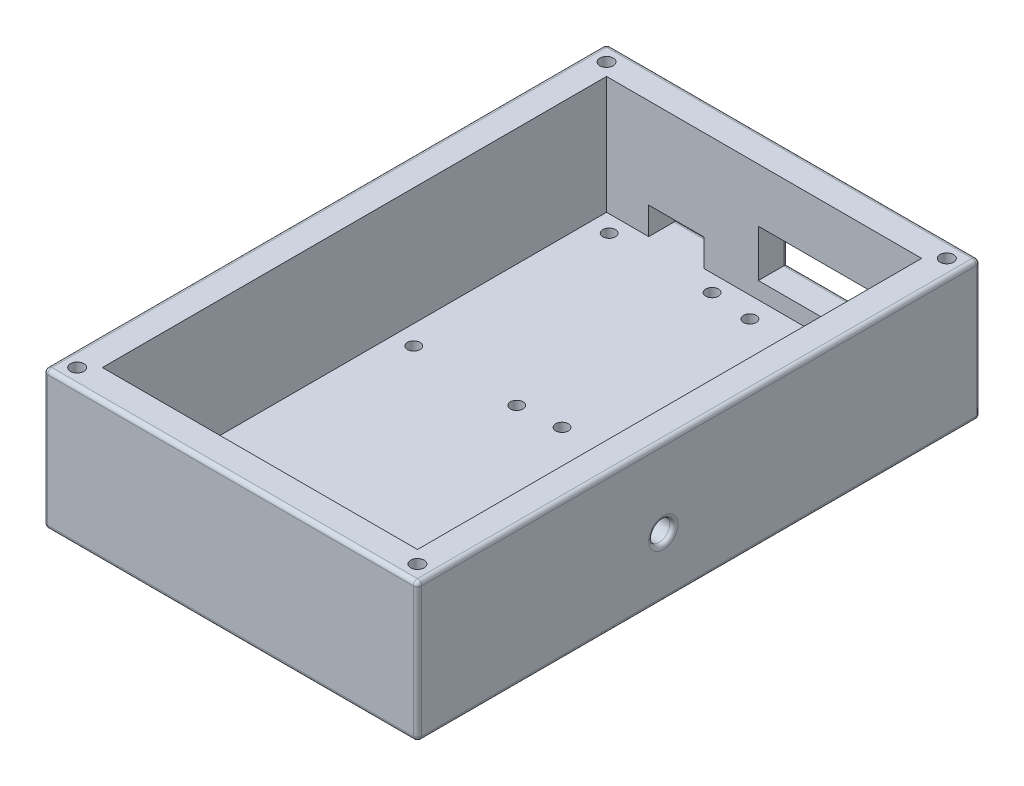
from build123d import *

# Parameters (mm, degrees)
SKETCH_1_W          = 89
SKETCH_1_H          = 134
EXTRUDE_2_DEPTH     = 16.5
SKETCH_4_W          = 75
SKETCH_4_H          = 120
CUT_EXTRUDE_1_DEPTH = 28
CUT_EXTRUDE1_REACH  = 88.938
SKETCH4_R           = 1.5
CUT_EXTRUDE2_REACH  = 144.157
SKETCH7_W           = 13.210021701
SKETCH7_H           = 6.5
SKETCH7_W_2         = 36.926143907
SKETCH7_H_2         = 11.2004
CUT_EXTRUDE3_REACH  = 114.615
SKETCH8_R           = 2.5
FILLET3_R           = 1
SKETCH9_R           = 1.6
CUT_EXTRUDE4_DEPTH  = 87.938196439
CUT_EXTRUDE5_DEPTH  = 2.5


with BuildPart() as part:
    # 草圖1 → 填料-伸長2 (new, symmetric)
    with BuildSketch(Plane(origin=(0, 0, 0), x_dir=(1, 0, 0), z_dir=(0, 1, 0))):
        Rectangle(SKETCH_1_W, SKETCH_1_H)
    extrude(amount=EXTRUDE_2_DEPTH, both=True)

    # 草圖4 → 除料-伸長1 (cut)
    with BuildSketch(Plane(origin=(0, 16.5, 0), x_dir=(1, 0, 0), z_dir=(0, 1, 0))):
        Rectangle(SKETCH_4_W, SKETCH_4_H)
    extrude(amount=-CUT_EXTRUDE_1_DEPTH, mode=Mode.SUBTRACT)

    # Sketch4 → Cut-Extrude1 (cut, up to next)
    with BuildSketch(Plane.XZ.offset(16.5), mode=Mode.PRIVATE) as cut_extrude1_sk1:
        with Locations(Location((-32.8808, -9.5, 0), (0, 0, 270))):
            Circle(SKETCH4_R)
    cut_extrude1_tool1 = extrude(cut_extrude1_sk1.sketch, amount=-CUT_EXTRUDE1_REACH, mode=Mode.PRIVATE) & part.part
    # Sketch4 → Cut-Extrude1 (cut, up to next)
    with BuildSketch(Plane.XZ.offset(16.5), mode=Mode.PRIVATE) as cut_extrude1_sk2:
        with Locations(Location((-8.3808, -9.5, 0), (0, 0, 270))):
            Circle(SKETCH4_R)
    cut_extrude1_tool2 = extrude(cut_extrude1_sk2.sketch, amount=-CUT_EXTRUDE1_REACH, mode=Mode.PRIVATE) & part.part
    # Sketch4 → Cut-Extrude1 (cut, up to next)
    with BuildSketch(Plane.XZ.offset(16.5), mode=Mode.PRIVATE) as cut_extrude1_sk3:
        with Locations(Location((-32.8808, -56, 0), (0, 0, 270))):
            Circle(SKETCH4_R)
    cut_extrude1_tool3 = extrude(cut_extrude1_sk3.sketch, amount=-CUT_EXTRUDE1_REACH, mode=Mode.PRIVATE) & part.part
    # Sketch4 → Cut-Extrude1 (cut, up to next)
    with BuildSketch(Plane.XZ.offset(16.5), mode=Mode.PRIVATE) as cut_extrude1_sk4:
        with Locations(Location((-8.3808, -56, 0), (0, 0, 270))):
            Circle(SKETCH4_R)
    cut_extrude1_tool4 = extrude(cut_extrude1_sk4.sketch, amount=-CUT_EXTRUDE1_REACH, mode=Mode.PRIVATE) & part.part
    # Sketch4 → Cut-Extrude1 (cut, up to next)
    with BuildSketch(Plane.XZ.offset(16.5), mode=Mode.PRIVATE) as cut_extrude1_sk5:
        with Locations(Location((1.5402, -10.375, 0), (0, 0, 270))):
            Circle(SKETCH4_R)
    cut_extrude1_tool5 = extrude(cut_extrude1_sk5.sketch, amount=-CUT_EXTRUDE1_REACH, mode=Mode.PRIVATE) & part.part
    # Sketch4 → Cut-Extrude1 (cut, up to next)
    with BuildSketch(Plane.XZ.offset(16.5), mode=Mode.PRIVATE) as cut_extrude1_sk6:
        with Locations(Location((32.579, -10.375, 0), (0, 0, 270))):
            Circle(SKETCH4_R)
    cut_extrude1_tool6 = extrude(cut_extrude1_sk6.sketch, amount=-CUT_EXTRUDE1_REACH, mode=Mode.PRIVATE) & part.part
    # Sketch4 → Cut-Extrude1 (cut, up to next)
    with BuildSketch(Plane.XZ.offset(16.5), mode=Mode.PRIVATE) as cut_extrude1_sk7:
        with Locations(Location((1.5402, -55.079, 0), (0, 0, 270))):
            Circle(SKETCH4_R)
    cut_extrude1_tool7 = extrude(cut_extrude1_sk7.sketch, amount=-CUT_EXTRUDE1_REACH, mode=Mode.PRIVATE) & part.part
    # Sketch4 → Cut-Extrude1 (cut, up to next)
    with BuildSketch(Plane.XZ.offset(16.5), mode=Mode.PRIVATE) as cut_extrude1_sk8:
        with Locations(Location((32.579, -55.079, 0), (0, 0, 270))):
            Circle(SKETCH4_R)
    cut_extrude1_tool8 = extrude(cut_extrude1_sk8.sketch, amount=-CUT_EXTRUDE1_REACH, mode=Mode.PRIVATE) & part.part
    add(cut_extrude1_tool1.solids().sort_by_distance((-32.8808, -16.5, -9.5))[0], mode=Mode.SUBTRACT)
    add(cut_extrude1_tool2.solids().sort_by_distance((-8.3808, -16.5, -9.5))[0], mode=Mode.SUBTRACT)
    add(cut_extrude1_tool3.solids().sort_by_distance((-32.8808, -16.5, -56))[0], mode=Mode.SUBTRACT)
    add(cut_extrude1_tool4.solids().sort_by_distance((-8.3808, -16.5, -56))[0], mode=Mode.SUBTRACT)
    add(cut_extrude1_tool5.solids().sort_by_distance((1.5402, -16.5, -10.375))[0], mode=Mode.SUBTRACT)
    add(cut_extrude1_tool6.solids().sort_by_distance((32.579, -16.5, -10.375))[0], mode=Mode.SUBTRACT)
    add(cut_extrude1_tool7.solids().sort_by_distance((1.5402, -16.5, -55.079))[0], mode=Mode.SUBTRACT)
    add(cut_extrude1_tool8.solids().sort_by_distance((32.579, -16.5, -55.079))[0], mode=Mode.SUBTRACT)

    # Sketch7 → Cut-Extrude2 (cut, up to next)
    with BuildSketch(Plane(origin=(0, 0, -67), x_dir=(-1, 0, 0), z_dir=(0, 0, -1)), mode=Mode.PRIVATE) as cut_extrude2_sk1:
        with Locations((20.850501077, -8.25)):
            Rectangle(SKETCH7_W, SKETCH7_H)
    cut_extrude2_tool1 = extrude(cut_extrude2_sk1.sketch, amount=-CUT_EXTRUDE2_REACH, mode=Mode.PRIVATE) & part.part
    # Sketch7 → Cut-Extrude2 (cut, up to next)
    with BuildSketch(Plane(origin=(0, 0, -67), x_dir=(-1, 0, 0), z_dir=(0, 0, -1)), mode=Mode.PRIVATE) as cut_extrude2_sk2:
        with Locations((-17.096479408, -1.8998)):
            Rectangle(SKETCH7_W_2, SKETCH7_H_2)
    cut_extrude2_tool2 = extrude(cut_extrude2_sk2.sketch, amount=-CUT_EXTRUDE2_REACH, mode=Mode.PRIVATE) & part.part
    add(cut_extrude2_tool1.solids().sort_by_distance((-20.850501, -8.25, -67))[0], mode=Mode.SUBTRACT)
    add(cut_extrude2_tool2.solids().sort_by_distance((17.096479, -1.8998, -67))[0], mode=Mode.SUBTRACT)

    # Sketch8 → Cut-Extrude3 (cut, up to next)
    with BuildSketch(Plane(origin=(44.5, 0, 0), x_dir=(0, 0, -1), z_dir=(1, 0, 0)), mode=Mode.PRIVATE) as cut_extrude3_sk1:
        with Locations((-8.471, -2.3)):
            Circle(SKETCH8_R)
    cut_extrude3_tool1 = extrude(cut_extrude3_sk1.sketch, amount=-CUT_EXTRUDE3_REACH, mode=Mode.PRIVATE) & part.part
    add(cut_extrude3_tool1.solids().sort_by_distance((44.5, -2.3, 8.471))[0], mode=Mode.SUBTRACT)

    # Fillet3
    fillet3_edges = [part.edges().sort_by_distance(p)[0] for p in [
        (-44.5, 16.5, 0),
        (0, 16.5, 67),
        (44.5, 16.5, 0),
        (0, -16.5, 67),
        (-44.5, -16.5, 0),
        (0, -16.5, -67),
        (44.5, -16.5, 0),
        (-20.850501078, -5, -67),
        (-14.245490227, -8.25, -67),
        (-20.850501078, -11.5, -67),
        (-27.455511928, -8.25, -67),
        (17.096479408, 3.7004, -67),
        (35.559551361, -1.8998, -67),
        (17.096479408, -7.5, -67),
        (-1.366592546, -1.8998, -67),
        (44.5, 0, 67),
        (-44.5, 0, 67),
        (-44.5, 0, -67),
        (44.5, 0, -67),
        (44.5, -2.3, 10.971),
        (0, 16.5, -67),
    ]]
    fillet(fillet3_edges, radius=FILLET3_R)

    # Sketch9 → Cut-Extrude4 (cut, through all)
    with BuildSketch(Plane(origin=(0, 16.5, 0), x_dir=(1, 0, 0), z_dir=(0, 1, 0))):
        with Locations(Location((-40.49479618, 62.99479618, 0), (0, 0, 270))):
            Circle(SKETCH9_R)
        with Locations(Location((40.49479618, 62.99479618, 0), (0, 0, 270))):
            Circle(SKETCH9_R)
        with Locations(Location((40.49479618, -62.99479618, 0), (0, 0, 270))):
            Circle(SKETCH9_R)
        with Locations(Location((-40.49479618, -62.99479618, 0), (0, 0, 270))):
            Circle(SKETCH9_R)
    extrude(amount=-CUT_EXTRUDE4_DEPTH, mode=Mode.SUBTRACT)

    # Sketch10 → Cut-Extrude5 (cut)
    with BuildSketch(Plane.XZ.offset(16.5)):
        Polygon((-40.49479618, 66.170222661), (-43.24479618, 64.58250942), (-43.24479618, 61.40708294), (-40.49479618, 59.819369699), (-37.74479618, 61.40708294), (-37.74479618, 64.58250942), align=None)
        Polygon((37.74479618, 64.58250942), (40.49479618, 66.170222661), (43.24479618, 64.58250942), (43.24479618, 61.40708294), (40.49479618, 59.819369699), (37.74479618, 61.40708294), align=None)
        Polygon((37.74479618, -61.40708294), (37.74479618, -64.58250942), (40.49479618, -66.170222661), (43.24479618, -64.58250942), (43.24479618, -61.40708294), (40.49479618, -59.819369699), align=None)
        Polygon((-37.74479618, -64.58250942), (-40.49479618, -66.170222661), (-43.24479618, -64.58250942), (-43.24479618, -61.40708294), (-40.49479618, -59.819369699), (-37.74479618, -61.40708294), align=None)
    extrude(amount=-CUT_EXTRUDE5_DEPTH, mode=Mode.SUBTRACT)


solid = part.part
